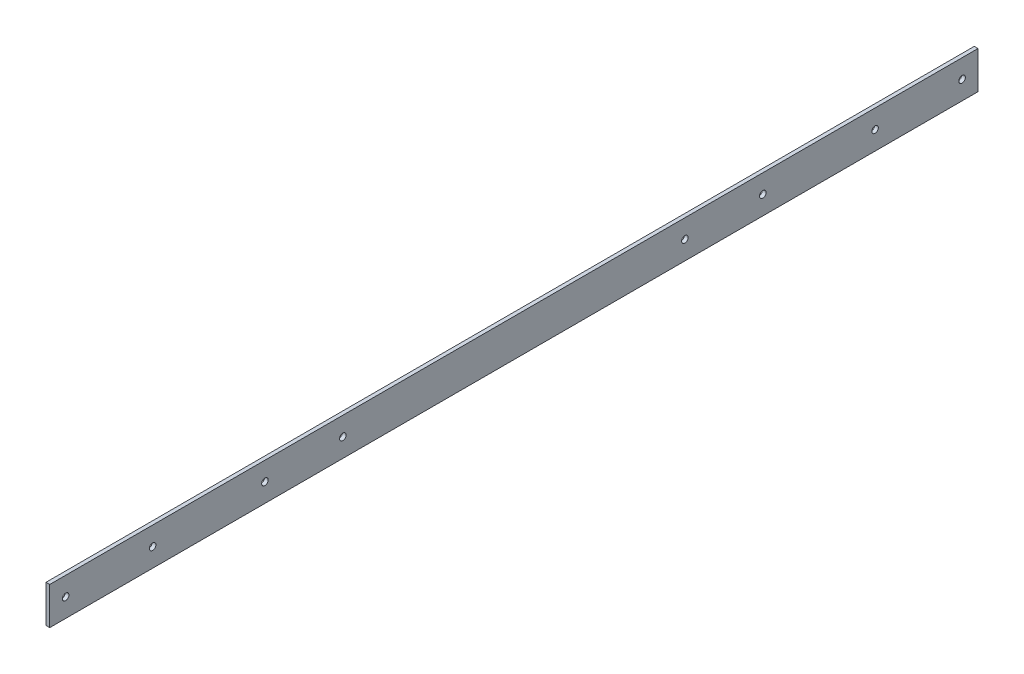
from build123d import *

# Parameters (mm, degrees)
SKETCH_1_W          = 2
SKETCH_1_H          = 20
EXTRUDE_1_DEPTH     = 496
SKETCH_2_R          = 1.75
CUT_EXTRUDE_1_DEPTH = 497.407091005


with BuildPart() as part:
    # Эскиз1 → Бобышка-Вытянуть1 (new body)
    with BuildSketch(Plane.XY):
        with Locations((1, 10)):
            Rectangle(SKETCH_1_W, SKETCH_1_H)
    extrude(amount=EXTRUDE_1_DEPTH)

    # Эскиз2 → Вырез-Вытянуть1 (cut, through all)
    with BuildSketch(Plane(origin=(2, 0, 0), x_dir=(0, 0, -1), z_dir=(1, 0, 0))):
        with Locations((-487.5, 10)):
            Circle(SKETCH_2_R)
        with Locations((-441, 10)):
            Circle(SKETCH_2_R)
        with Locations((-381.01, 10)):
            Circle(SKETCH_2_R)
        with Locations((-339.4, 10)):
            Circle(SKETCH_2_R)
    cut_extrude_1 = extrude(amount=-CUT_EXTRUDE_1_DEPTH, mode=Mode.SUBTRACT)

    # Зеркальное отражение1: Вырез-Вытянуть1 across plane
    add(cut_extrude_1.mirror(Plane(origin=(0, 0, 248), x_dir=(1, 0, 0), z_dir=(0, 0, -1))), mode=Mode.SUBTRACT)


solid = part.part
